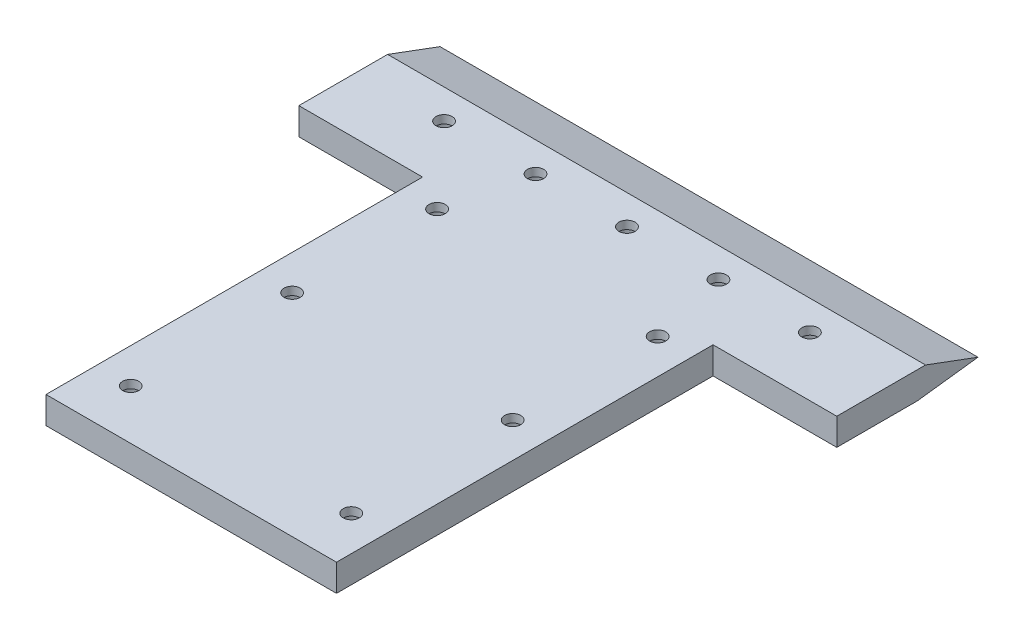
from build123d import *

# Parameters (mm, degrees)
SALIENTE_EXTRUIR1_DEPTH = 5.02
CORTAR_EXTRUIR1_DEPTH   = 100
CROQUIS4_R              = 1.5
CORTAR_EXTRUIR2_DEPTH   = 10
CROQUIS5_R              = 3
CORTAR_EXTRUIR3_DEPTH   = 3.5
CORTAR_EXTRUIR4_DEPTH   = 100


with BuildPart() as part:
    # Croquis1 → Saliente-Extruir1 (new body)
    with BuildSketch(Plane(origin=(0, 0, 0), x_dir=(1, 0, 0), z_dir=(0, 1, 0))):
        Polygon((-46.116523403, 70), (-46.116523403, 100), (53.883476597, 100), (53.883476597, 70), (30.883476597, 70), (30.883476597, 40), (30.883476597, 0), (26.883476597, 0), (-19.116523403, 0), (-23.116523403, 0), (-23.116523403, 40), (-23.116523403, 70), align=None)
    extrude(amount=SALIENTE_EXTRUIR1_DEPTH)

    # Croquis2 → Cortar-Extruir1 (cut)
    with BuildSketch(Plane.ZY.offset(46.116523403)):
        Polygon((-100, 0), (-86.5, 5.02), (-100, 5.02), align=None)
    extrude(amount=-CORTAR_EXTRUIR1_DEPTH, mode=Mode.SUBTRACT)

    # Croquis4 → Cortar-Extruir2 (cut)
    with BuildSketch(Plane.XZ):
        with Locations(Location((3.883476597, -81, 0), (0, 0, 270))):
            Circle(CROQUIS4_R)
        with Locations(Location((24.383476597, -9.25, 0), (0, 0, 270))):
            Circle(CROQUIS4_R)
        with Locations(Location((-30.116523403, -81, 0), (0, 0, 270))):
            Circle(CROQUIS4_R)
        with Locations(Location((-13.116523403, -81, 0), (0, 0, 270))):
            Circle(CROQUIS4_R)
        with Locations(Location((24.383476597, -66.2, 0), (0, 0, 270))):
            Circle(CROQUIS4_R)
        with Locations(Location((24.383476597, -39.25, 0), (0, 0, 270))):
            Circle(CROQUIS4_R)
        with Locations(Location((-16.616523403, -9.25, 0), (0, 0, 270))):
            Circle(CROQUIS4_R)
        with Locations(Location((-16.616523403, -39.25, 0), (0, 0, 270))):
            Circle(CROQUIS4_R)
        with Locations(Location((-16.616523403, -66.2, 0), (0, 0, 270))):
            Circle(CROQUIS4_R)
        with Locations(Location((20.883476597, -81, 0), (0, 0, 270))):
            Circle(CROQUIS4_R)
        with Locations(Location((37.883476597, -81, 0), (0, 0, 270))):
            Circle(CROQUIS4_R)
    extrude(amount=-CORTAR_EXTRUIR2_DEPTH, mode=Mode.SUBTRACT)

    # Croquis5 → Cortar-Extruir3 (cut)
    with BuildSketch(Plane.XZ):
        with Locations(Location((24.383476597, -9.25, 0), (0, 0, 270))):
            Circle(CROQUIS5_R)
        with Locations(Location((24.383476597, -39.25, 0), (0, 0, 270))):
            Circle(CROQUIS5_R)
        with Locations(Location((24.383476597, -66.2, 0), (0, 0, 270))):
            Circle(CROQUIS5_R)
        with Locations(Location((-16.616523403, -66.2, 0), (0, 0, 90))):
            Circle(CROQUIS5_R)
        with Locations(Location((-16.616523403, -39.25, 0), (0, 0, 90))):
            Circle(CROQUIS5_R)
        with Locations(Location((-16.616523403, -9.25, 0), (0, 0, 90))):
            Circle(CROQUIS5_R)
        with Locations(Location((3.883476597, -81, 0), (0, 0, 270))):
            Circle(CROQUIS5_R)
        with Locations(Location((20.883476597, -81, 0), (0, 0, 270))):
            Circle(CROQUIS5_R)
        with Locations(Location((37.883476597, -81, 0), (0, 0, 270))):
            Circle(CROQUIS5_R)
        with Locations(Location((-30.116523403, -81, 0), (0, 0, 90))):
            Circle(CROQUIS5_R)
        with Locations(Location((-13.116523403, -81, 0), (0, 0, 90))):
            Circle(CROQUIS5_R)
    extrude(amount=-CORTAR_EXTRUIR3_DEPTH, mode=Mode.SUBTRACT)

    # Croquis6 → Cortar-Extruir4 (cut)
    with BuildSketch(Plane.ZY.offset(46.116523403)):
        Polygon((-100, 0), (-85, 0), (-96.250817152, 1.394140585), align=None)
    extrude(amount=-CORTAR_EXTRUIR4_DEPTH, mode=Mode.SUBTRACT)


solid = part.part
